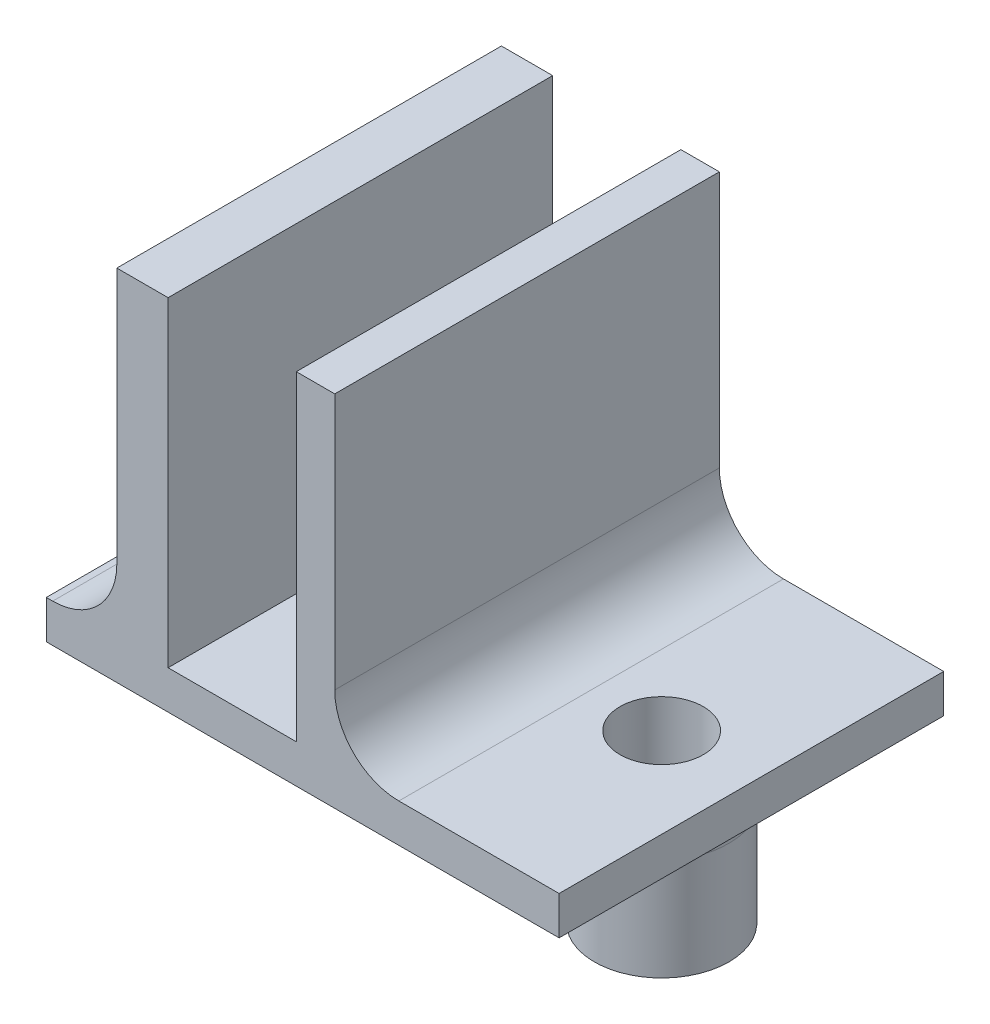
from build123d import *

# Parameters (mm, degrees)
BOSS_EXTRU_1_DEPTH      = 30
ESQUISSE2_R             = 3.25
ENL_V_MAT_EXTRU_1_DEPTH = 56.901699437
ESQUISSE3_R             = 5.25
ESQUISSE3_R_2           = 3.25
EXTRU_MINCE1_DEPTH      = 10
ESQUISSE5_W             = 3
ESQUISSE5_H             = 25
BOSS_EXTRU_3_DEPTH      = 30
CONG_1_R                = 5
CONG_2_R                = 2
EXTRU_MINCE2_START      = -10
EXTRU_MINCE2_DEPTH      = 10


with BuildPart() as part:
    # Esquisse1 → Boss.-Extru.1 (new body)
    with BuildSketch(Plane.XY):
        with BuildLine():
            Line((0, 0), (40, 0))
            Line((40, 0), (40, 3))
            Line((40, 3), (9.5, 3))
            Line((9.5, 3), (9.5, 28))
            Line((9.5, 28), (5.5, 28))
            Line((5.5, 28), (5.5, 8))
            ThreePointArc((5.5, 8), (4.035533906, 4.464466094), (0.5, 3))
            Line((0.5, 3), (0, 3))
            Line((0, 3), (0, 0))
        make_face()
    extrude(amount=BOSS_EXTRU_1_DEPTH)

    # Esquisse2 → Enlèv. mat.-Extru.1 (cut, through all)
    with BuildSketch(Plane(origin=(0, 3, 0), x_dir=(1, 0, 0), z_dir=(0, 1, 0))):
        with Locations(Location((33, -15, 0), (0, 0, 270))):
            Circle(ESQUISSE2_R)
    extrude(amount=-ENL_V_MAT_EXTRU_1_DEPTH, mode=Mode.SUBTRACT)

    # Esquisse3 → Extru.-Mince1 (add)
    with BuildSketch(Plane(origin=(0, 0, 0), x_dir=(-1, 0, 0), z_dir=(0, -1, 0))):
        with Locations((-33, -15)):
            Circle(ESQUISSE3_R)
        with Locations((-33, -15)):
            Circle(ESQUISSE3_R_2, mode=Mode.SUBTRACT)
    extrude(amount=EXTRU_MINCE1_DEPTH)

    # Esquisse5 → Boss.-Extru.3 (add)
    with BuildSketch(Plane.XY.offset(30)):
        with Locations((21, 15.5)):
            Rectangle(ESQUISSE5_W, ESQUISSE5_H)
    extrude(amount=-BOSS_EXTRU_3_DEPTH)

    # Congé1
    cong_1_edges = [part.edges().sort_by_distance(p)[0] for p in [
        (22.5, 3, 15),
    ]]
    fillet(cong_1_edges, radius=CONG_1_R)

    # Congé2
    cong_2_edges = [part.edges().sort_by_distance(p)[0] for p in [
        (38.25, 0, 15),
    ]]
    fillet(cong_2_edges, radius=CONG_2_R)

    # Esquisse6 → Extru.-Mince2 (add)
    with BuildSketch(Plane.XY.offset(30).offset(EXTRU_MINCE2_START)):
        Polygon((29.75, -10), (19.75, 0), (29.75, 0), align=None)
        Polygon((27.75, -5.171572875), (24.578427125, -2), (27.75, -2), align=None, mode=Mode.SUBTRACT)
    extrude(amount=-EXTRU_MINCE2_DEPTH)


solid = part.part
